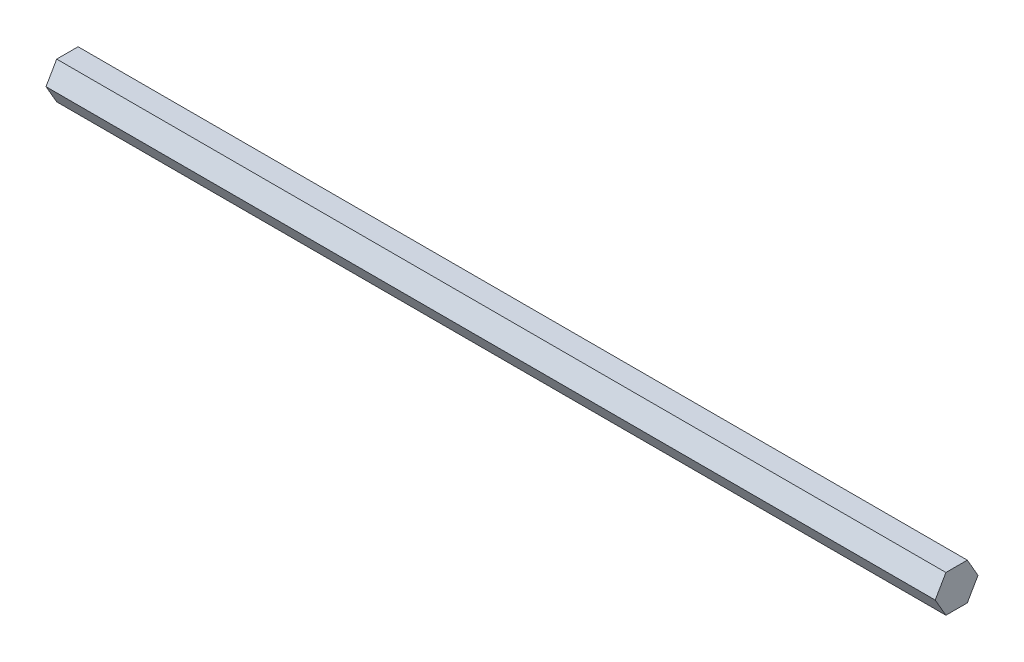
from build123d import *

# Parameters (mm, degrees)
BOSS_EXTRUDE1_DEPTH = 152.4


with BuildPart() as part:
    # Sketch1 → Boss-Extrude1 (new, symmetric)
    with BuildSketch(Plane(origin=(0, 0, 0), x_dir=(0, 0, -1), z_dir=(1, 0, 0))):
        Polygon((3.666174209, 6.35), (-3.666174209, 6.35), (-7.332348419, 0), (-3.666174209, -6.35), (3.666174209, -6.35), (7.332348419, 0), align=None)
    extrude(amount=BOSS_EXTRUDE1_DEPTH, both=True)


solid = part.part
